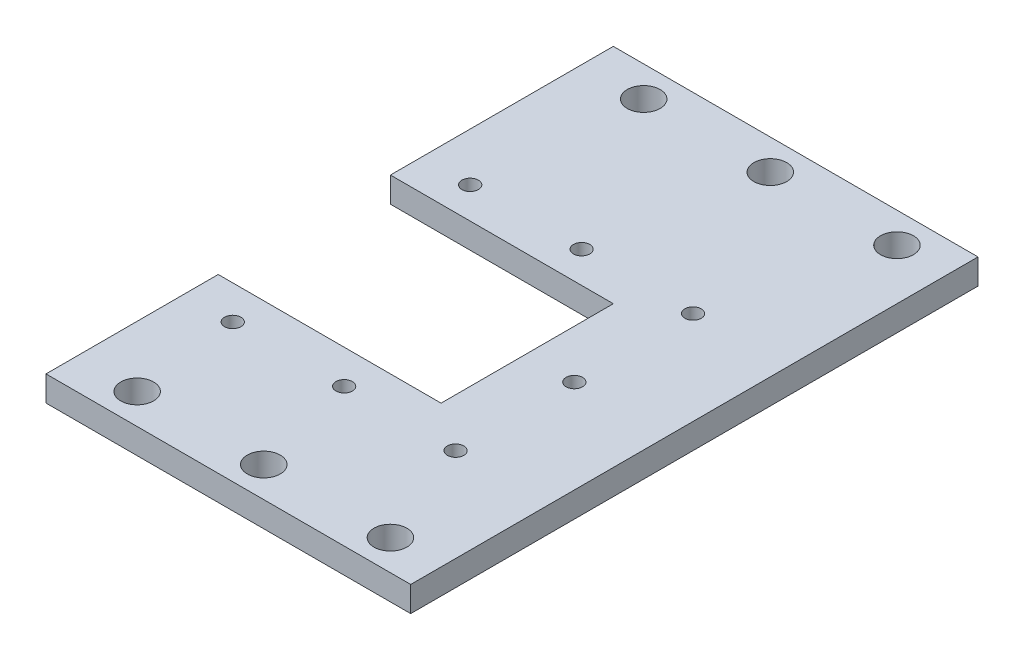
from build123d import *

# Parameters (mm, degrees)
SKETCH1_W           = 114.3
SKETCH1_H           = 177.8
BOSS_EXTRUDE1_DEPTH = 3.9624
CUT_EXTRUDE2_START  = 3.9624
SKETCH2_W           = 184.15
SKETCH2_H           = 53.975
CUT_EXTRUDE2_DEPTH  = 110.721716912
CUT_EXTRUDE4_START  = 3.9624
SKETCH3_R           = 5.1562
CUT_EXTRUDE4_DEPTH  = 110.721716912
CUT_EXTRUDE6_START  = 3.9624
SKETCH4_R           = 5.1562
CUT_EXTRUDE6_DEPTH  = 110.721716912
CUT_EXTRUDE8_START  = 3.9624
SKETCH5_R           = 5.1562
CUT_EXTRUDE8_DEPTH  = 110.721716912
CUT_EXTRUDE10_START = 3.9624
SKETCH6_R           = 2.5781
CUT_EXTRUDE10_DEPTH = 114.3
CUT_EXTRUDE12_START = 3.9624
SKETCH7_R           = 2.5781
CUT_EXTRUDE12_DEPTH = 114.3


with BuildPart() as part:
    # Sketch1 → Boss-Extrude1 (new, symmetric)
    with BuildSketch(Plane(origin=(0, 0, 0), x_dir=(1, 0, 0), z_dir=(0, 1, 0))):
        Rectangle(SKETCH1_W, SKETCH1_H)
    extrude(amount=BOSS_EXTRUDE1_DEPTH, both=True)

    # Sketch2 → Cut-Extrude2 (cut, through all)
    with BuildSketch(Plane(origin=(0, 0, 0), x_dir=(1, 0, 0), z_dir=(0, 1, 0)).offset(CUT_EXTRUDE2_START)):
        with Locations((-79.375, -7.9375)):
            Rectangle(SKETCH2_W, SKETCH2_H)
    extrude(amount=-CUT_EXTRUDE2_DEPTH, mode=Mode.SUBTRACT)

    # Sketch3 → Cut-Extrude4 (cut, through all)
    with BuildSketch(Plane(origin=(0, 0, 0), x_dir=(1, 0, 0), z_dir=(0, 1, 0)).offset(CUT_EXTRUDE4_START)):
        with Locations(Location((-38.1, -79.375, 0), (0, 0, 270))):
            Circle(SKETCH3_R)
        with Locations(Location((-38.1, 79.375, 0), (0, 0, 270))):
            Circle(SKETCH3_R)
    extrude(amount=-CUT_EXTRUDE4_DEPTH, mode=Mode.SUBTRACT)

    # Sketch4 → Cut-Extrude6 (cut, through all)
    with BuildSketch(Plane(origin=(0, 0, 0), x_dir=(1, 0, 0), z_dir=(0, 1, 0)).offset(CUT_EXTRUDE6_START)):
        with Locations(Location((1.5748, -79.375, 0), (0, 0, 270))):
            Circle(SKETCH4_R)
        with Locations(Location((1.5748, 79.375, 0), (0, 0, 270))):
            Circle(SKETCH4_R)
    extrude(amount=-CUT_EXTRUDE6_DEPTH, mode=Mode.SUBTRACT)

    # Sketch5 → Cut-Extrude8 (cut, through all)
    with BuildSketch(Plane(origin=(0, 0, 0), x_dir=(1, 0, 0), z_dir=(0, 1, 0)).offset(CUT_EXTRUDE8_START)):
        with Locations(Location((41.275, -79.375, 0), (0, 0, 270))):
            Circle(SKETCH5_R)
        with Locations(Location((41.275, 79.375, 0), (0, 0, 270))):
            Circle(SKETCH5_R)
    extrude(amount=-CUT_EXTRUDE8_DEPTH, mode=Mode.SUBTRACT)

    # Sketch6 → Cut-Extrude10 (cut)
    with BuildSketch(Plane(origin=(0, 0, 0), x_dir=(1, 0, 0), z_dir=(0, 1, 0)).offset(CUT_EXTRUDE10_START)):
        with Locations(Location((-41.9862, -45.5422, 0), (0, 0, 270))):
            Circle(SKETCH6_R)
        with Locations(Location((-7.0612, -45.5422, 0), (0, 0, 270))):
            Circle(SKETCH6_R)
        with Locations(Location((27.8638, -45.5422, 0), (0, 0, 270))):
            Circle(SKETCH6_R)
        with Locations(Location((-41.9862, 28.8798, 0), (0, 0, 270))):
            Circle(SKETCH6_R)
        with Locations(Location((-7.0612, 28.8798, 0), (0, 0, 270))):
            Circle(SKETCH6_R)
        with Locations(Location((27.8638, 28.8798, 0), (0, 0, 270))):
            Circle(SKETCH6_R)
    extrude(amount=-CUT_EXTRUDE10_DEPTH, mode=Mode.SUBTRACT)

    # Sketch7 → Cut-Extrude12 (cut)
    with BuildSketch(Plane(origin=(0, 0, 0), x_dir=(1, 0, 0), z_dir=(0, 1, 0)).offset(CUT_EXTRUDE12_START)):
        with Locations(Location((27.8638, -8.3312, 0), (0, 0, 270))):
            Circle(SKETCH7_R)
    extrude(amount=-CUT_EXTRUDE12_DEPTH, mode=Mode.SUBTRACT)


solid = part.part
